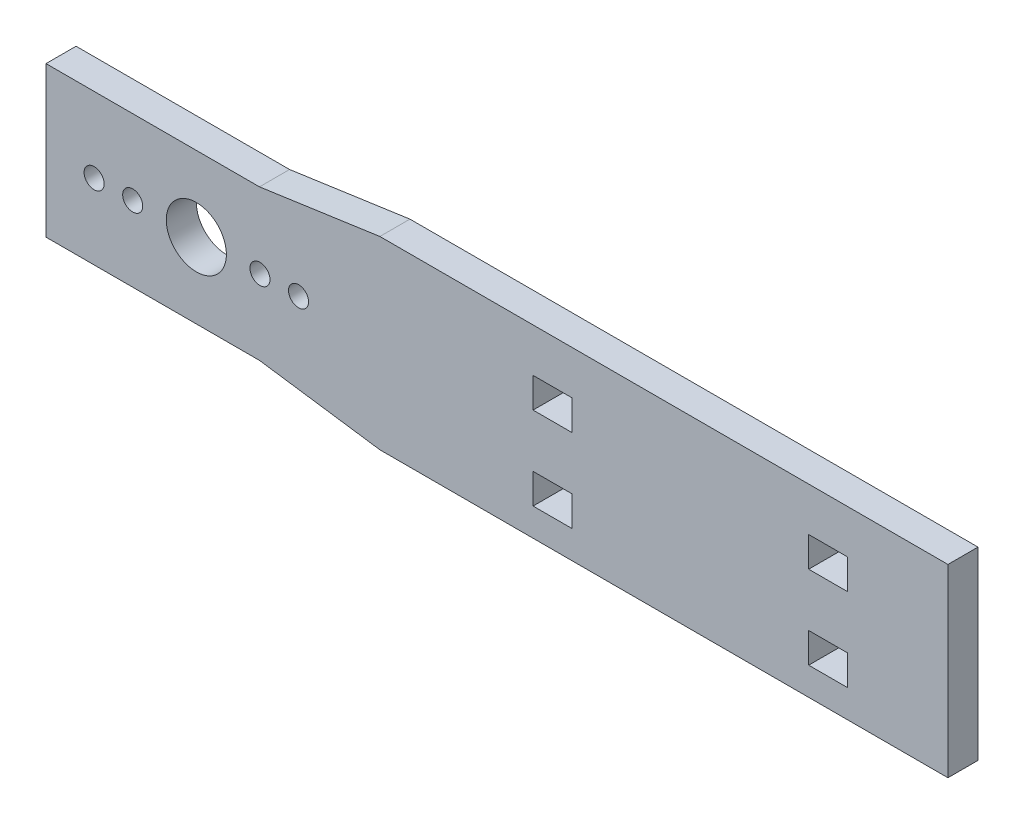
from build123d import *

# Parameters (mm, degrees)
SKETCH1_R           = 3
SKETCH1_W           = 3.88
SKETCH1_H           = 3
BOSS_EXTRUDE1_DEPTH = 3
SKETCH2_R           = 1.0009
CUT_EXTRUDE1_DEPTH  = 516.692890771


with BuildPart() as part:
    # Sketch1 → Boss-Extrude1 (new body)
    with BuildSketch(Plane.XY):
        Polygon((-398.2841, 298.0765), (-386.271234014, 299.794262601), (-329.587365996, 299.794262601), (-329.587365996, 281.358737399), (-386.271234014, 281.358737399), (-398.2841, 283.0765), (-419.587365996, 283.0765), (-419.587365996, 298.0765), align=None)
        with Locations((-404.586054436, 290.5765)):
            Circle(SKETCH1_R, mode=Mode.SUBTRACT)
        with Locations((-369.044562351, 293.935134885)):
            Rectangle(SKETCH1_W, SKETCH1_H, mode=Mode.SUBTRACT)
        with Locations((-369.044562351, 285.640934885)):
            Rectangle(SKETCH1_W, SKETCH1_H, mode=Mode.SUBTRACT)
        with Locations((-341.542562351, 293.935134885)):
            Rectangle(SKETCH1_W, SKETCH1_H, mode=Mode.SUBTRACT)
        with Locations((-341.542562351, 285.640934885)):
            Rectangle(SKETCH1_W, SKETCH1_H, mode=Mode.SUBTRACT)
    extrude(amount=BOSS_EXTRUDE1_DEPTH)

    # Sketch2 → Cut-Extrude1 (cut, through all)
    with BuildSketch(Plane.XY.offset(3)):
        with Locations((-414.786054436, 290.5765)):
            Circle(SKETCH2_R)
        with Locations((-410.936054436, 290.5765)):
            Circle(SKETCH2_R)
        with Locations((-398.236054436, 290.5765)):
            Circle(SKETCH2_R)
        with Locations((-394.386054436, 290.5765)):
            Circle(SKETCH2_R)
    extrude(amount=-CUT_EXTRUDE1_DEPTH, mode=Mode.SUBTRACT)


solid = part.part
